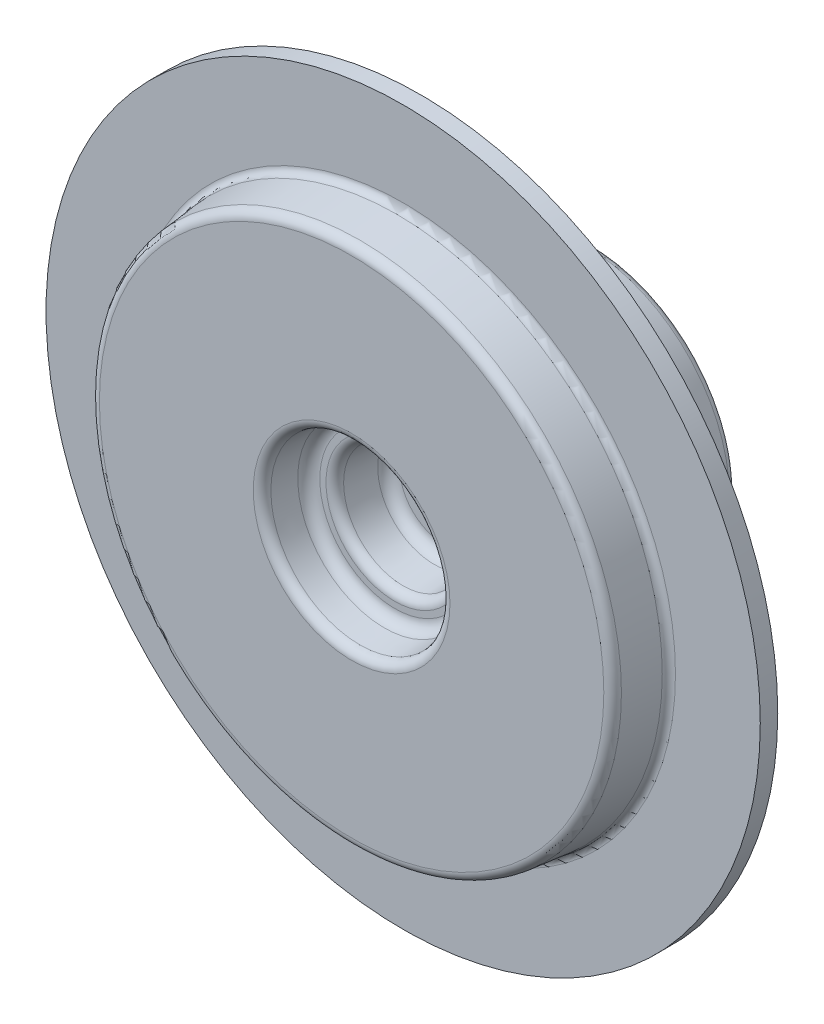
from build123d import *

# Parameters (mm, degrees)
FILLET1_R = 4
FILLET2_R = 4
FILLET3_R = 4
FILLET4_R = 5
FILLET5_R = 3


with BuildPart() as part:
    # Sketch1 → Revolve1 (revolve)
    with BuildSketch(Plane(origin=(0, 0, 0), x_dir=(1, 0, 0), z_dir=(0, 1, 0))):
        Polygon((26.1, 49.295987654), (36.655571648, 49.295987654), (38.6, 67.795987654), (61.6, 67.795987654), (65.99054182, 42.895987654), (76.6, 42.895987654), (79.280157999, 17.395987654), (111.218687718, 17.395987654), (114.124442337, -10.250420802), (127.794442337, -10.250420802), (144.31070644, -5.794495002), (153.205859624, -5.794495002), (153.205859624, -13.288420802), (114.124442337, -13.288420802), (111.8, -35.404012346), (38.6, -35.404012346), (36.655571648, -16.904012346), (25.889791529, -16.904012346), (23.652996684, 4.377669024), (0, 4.377669024), (0, 26.014306284), (23.652996684, 26.014306284), align=None)
    revolve(axis=Axis((0, 0, 1253.256856057), (0, 0, -1)))

    # Fillet1
    fillet1_edges = [part.edges().sort_by_distance(p)[0] for p in [
        (-61.6, 0, -67.795987654),
    ]]
    fillet(fillet1_edges, radius=FILLET1_R)

    # Fillet2
    fillet2_edges = [part.edges().sort_by_distance(p)[0] for p in [
        (-25.889791529, 0, 16.904012346),
        (-111.8, 0, 35.404012346),
        (-111.218687718, 0, -17.395987654),
        (-76.6, 0, -42.895987654),
        (-38.6, 0, -67.795987654),
        (-26.1, 0, -49.295987654),
    ]]
    fillet(fillet2_edges, radius=FILLET2_R)

    # Fillet3
    fillet3_edges = [part.edges().sort_by_distance(p)[0] for p in [
        (-38.6, 0, 35.404012346),
    ]]
    fillet(fillet3_edges, radius=FILLET3_R)

    # Fillet4
    fillet4_edges = [part.edges().sort_by_distance(p)[0] for p in [
        (-23.652996684, 0, -26.014306284),
        (-23.652996684, 0, -4.377669024),
        (-36.655571648, 0, 16.904012346),
        (-79.280157999, 0, -17.395987654),
        (-65.99054182, 0, -42.895987654),
        (-36.655571648, 0, -49.295987654),
    ]]
    fillet(fillet4_edges, radius=FILLET4_R)

    # Fillet5
    fillet5_edges = [part.edges().sort_by_distance(p)[0] for p in [
        (-114.124442337, 0, 13.288420802),
        (-114.124442337, 0, 10.250420802),
    ]]
    fillet(fillet5_edges, radius=FILLET5_R)


solid = part.part
